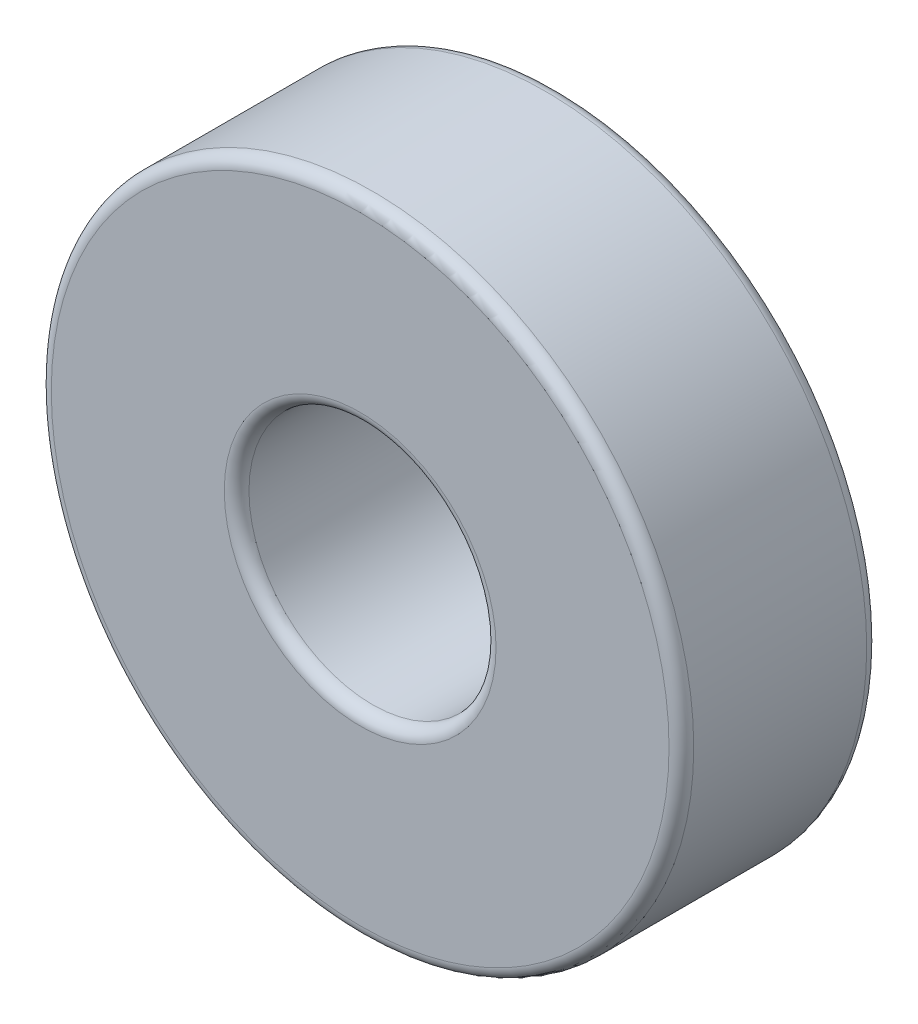
from build123d import *

# Parameters (mm, degrees)
CROQUIS1_R              = 13
CROQUIS1_R_2            = 5
SALIENTE_EXTRUIR1_DEPTH = 8
REDONDEO1_R             = 0.5


with BuildPart() as part:
    # Croquis1 → Saliente-Extruir1 (new body)
    with BuildSketch(Plane.XY):
        Circle(CROQUIS1_R)
        Circle(CROQUIS1_R_2, mode=Mode.SUBTRACT)
    extrude(amount=SALIENTE_EXTRUIR1_DEPTH)

    # Redondeo1
    redondeo1_edges = [part.edges().sort_by_distance(p)[0] for p in [
        (-13, 0, 0),
        (-13, 0, 8),
        (-5, 0, 0),
        (-5, 0, 8),
    ]]
    fillet(redondeo1_edges, radius=REDONDEO1_R)


solid = part.part
